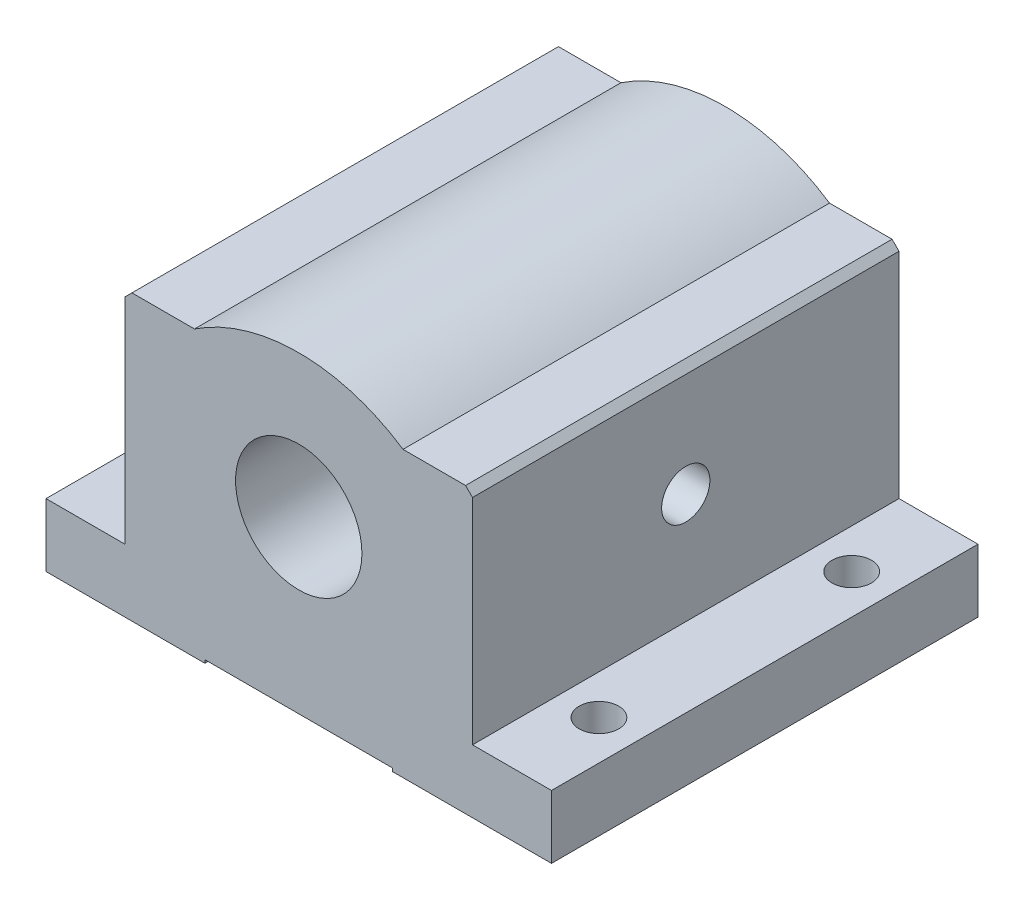
from build123d import *

# Parameters (mm, degrees)
BOSS_EXTRUDE1_START     = -21.43125
SKETCH4_R               = 6.35
BOSS_EXTRUDE1_DEPTH     = 42.8625
SKETCH5_R               = 1.984375
CUT_EXTRUDE1_DEPTH      = 42.828441001
CHAMFER1_SIZE           = 0.6985
CUT_EXTRUDE3_REACH      = 52.483
CUT_EXTRUDE3_END_RADIUS = 6.35
SKETCH7_R               = 2.4257


with BuildPart() as part:
    # Sketch4 → Boss-Extrude1 (new body)
    with BuildSketch(Plane.XY.offset(BOSS_EXTRUDE1_START)):
        with BuildLine():
            Line((-25.4, -9.525), (-17.4625, -9.525))
            Line((-17.4625, -9.525), (-17.4625, 12.7))
            Line((-17.4625, 12.7), (-10.4775, 12.7))
            ThreePointArc((-10.4775, 12.7), (0, 15.875), (10.4775, 12.7))
            Line((10.4775, 12.7), (17.4625, 12.7))
            Line((17.4625, 12.7), (17.4625, -9.525))
            Line((17.4625, -9.525), (25.4, -9.525))
            Line((25.4, -9.525), (25.4, -15.875))
            Line((25.4, -15.875), (9.42975, -15.875))
            Line((9.42975, -15.875), (9.42975, -15.5575))
            Line((9.42975, -15.5575), (-9.42975, -15.5575))
            Line((-9.42975, -15.5575), (-9.42975, -15.875))
            Line((-9.42975, -15.875), (-25.4, -15.875))
            Line((-25.4, -15.875), (-25.4, -9.525))
        make_face()
        with Locations((0, 1.5748)):
            Circle(SKETCH4_R, mode=Mode.SUBTRACT)
    extrude(amount=BOSS_EXTRUDE1_DEPTH)

    # Sketch5 → Cut-Extrude1 (cut, through all)
    with BuildSketch(Plane(origin=(0, -9.525, 0), x_dir=(1, 0, 0), z_dir=(0, 1, 0))):
        with Locations(Location((-21.4376, 12.7, 0), (0, 0, 180))):
            Circle(SKETCH5_R)
        with Locations(Location((21.4376, 12.7, 0), (0, 0, 180))):
            Circle(SKETCH5_R)
        with Locations(Location((21.4376, -12.7, 0), (0, 0, 180))):
            Circle(SKETCH5_R)
        with Locations(Location((-21.4376, -12.7, 0), (0, 0, 180))):
            Circle(SKETCH5_R)
    extrude(amount=-CUT_EXTRUDE1_DEPTH, mode=Mode.SUBTRACT)

    # Chamfer1
    chamfer1_edges = [part.edges().sort_by_distance(p)[0] for p in [
        (-17.4625, 12.7, 0),
        (17.4625, 12.7, 0),
    ]]
    chamfer(chamfer1_edges, length=CHAMFER1_SIZE)

    # Cut-Extrude3: up to this cylinder (the profile starts outside it)
    cut_extrude3_end = Plane(origin=(0, 1.5748, 0), z_dir=(0, 0, -1)) * Cylinder(CUT_EXTRUDE3_END_RADIUS, 118.666, mode=Mode.PRIVATE)
    # Sketch7 → Cut-Extrude3 (cut, up to the surface)
    with BuildSketch(Plane(origin=(17.4625, 0, 0), x_dir=(0, 0, -1), z_dir=(1, 0, 0)), mode=Mode.PRIVATE) as cut_extrude3_sk1:
        with Locations((0, 1.5748)):
            Circle(SKETCH7_R)
    cut_extrude3_tool1 = extrude(cut_extrude3_sk1.sketch, amount=-CUT_EXTRUDE3_REACH, mode=Mode.PRIVATE) - cut_extrude3_end
    add(cut_extrude3_tool1.solids().sort_by_distance((17.4625, 1.5748, 0))[0], mode=Mode.SUBTRACT)


solid = part.part
